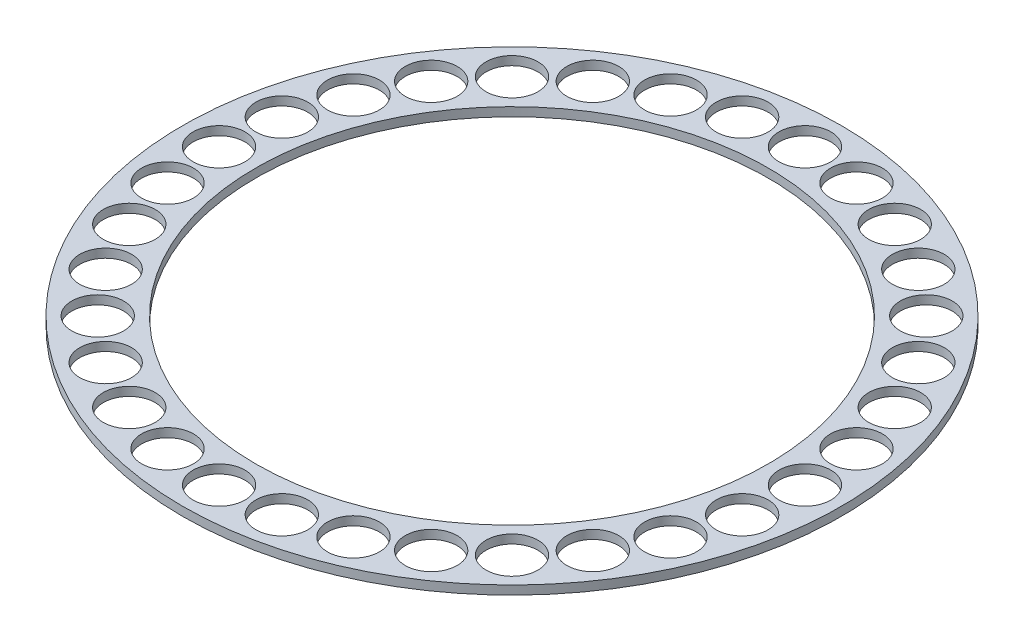
from build123d import *

# Parameters (mm, degrees)
SKETCH1_R               = 142.875
SKETCH1_R_2             = 11.25
BOSS_EXTRUDE2_DEPTH     = 3.81
SKETCH2_R               = 11.25
CUT_EXTRUDE1_DEPTH      = 203.091680556
CUT_EXTRUDE2_DEPTH      = 203.091680556
CUT_EXTRUDE2_DEPTH_BACK = 203.091680556
SKETCH4_R               = 111.125
CIRPATTERN1_COUNT       = 32


with BuildPart() as part:
    # Sketch1 → Boss-Extrude2 (new body)
    with BuildSketch(Plane(origin=(0, 0, 0), x_dir=(1, 0, 0), z_dir=(0, 1, 0))):
        with Locations(Location((0, 0, 0), (0, 0, 270))):
            Circle(SKETCH1_R)
        with Locations(Location((0, 0, 0), (0, 0, 270))):
            Circle(SKETCH1_R_2, mode=Mode.SUBTRACT)
    extrude(amount=-BOSS_EXTRUDE2_DEPTH)

    # Sketch2 → Cut-Extrude1 (cut, through all)
    with BuildSketch(Plane(origin=(0, 0, 0), x_dir=(1, 0, 0), z_dir=(0, 1, 0))):
        with Locations(Location((-127, 0, 0), (0, 0, 270))):
            Circle(SKETCH2_R)
    cut_extrude1 = extrude(amount=-CUT_EXTRUDE1_DEPTH, mode=Mode.SUBTRACT)

    # Sketch4 → Cut-Extrude2 (cut, two sides: drawn at the far end of the back side and taken through both)
    with BuildSketch(Plane(origin=(0, 0, 0), x_dir=(1, 0, 0), z_dir=(0, 1, 0)).offset(-CUT_EXTRUDE2_DEPTH_BACK)):
        with Locations(Location((0, 0, 0), (0, 0, 270))):
            Circle(SKETCH4_R)
    extrude(amount=CUT_EXTRUDE2_DEPTH + CUT_EXTRUDE2_DEPTH_BACK, mode=Mode.SUBTRACT)

    # CirPattern1: Cut-Extrude1 ×32 about axis
    cirpattern1_axis = Axis((0, 0, 0), (0, 1, 0))
    for i in range(1, CIRPATTERN1_COUNT):
        add(cut_extrude1.rotate(cirpattern1_axis, i * 360 / CIRPATTERN1_COUNT), mode=Mode.SUBTRACT)


solid = part.part
